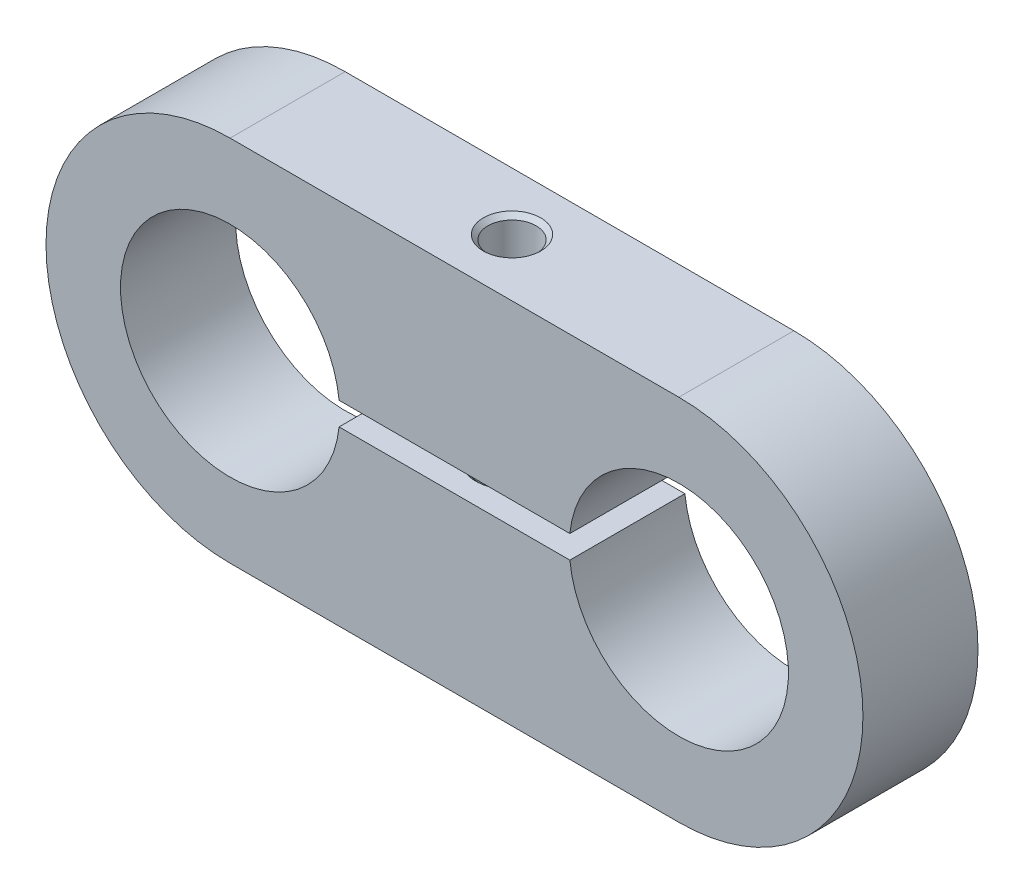
from build123d import *

# Parameters (mm, degrees)
BOSS_EXTRUDE1_DEPTH        = 10
CUT_EXTRUDE1_DEPTH         = 59.14636704
SKETCH3_W                  = 11
SKETCH3_H                  = 10
SKETCH4_W                  = 11
SKETCH4_H                  = 10
F_10_CLEARANCE_HOLE1_D     = 5.5
F_10_CLEARANCE_HOLE1_DEPTH = 15
F_6_CLEARANCE_HOLE1_D      = 4.2
F_6_CLEARANCE_HOLE1_DEPTH  = 32
CHAMFER1_SIZE              = 0.4
BOSS_EXTRUDE2_DEPTH        = 10


with BuildPart() as part:
    # Sketch1 → Boss-Extrude1 (new body)
    with BuildSketch(Plane(origin=(0, 0, 0), x_dir=(-1, 0, 0), z_dir=(0, 0, -1))):
        with BuildLine():
            Line((0, 16), (-39, 16))
            ThreePointArc((-39, 16), (-55, 0), (-39, -16))
            Line((-39, -16), (0, -16))
            ThreePointArc((0, -16), (16, 0), (0, 16))
        make_face()
    extrude(amount=-BOSS_EXTRUDE1_DEPTH)

    # Sketch2 → Cut-Extrude1 (cut, through all)
    with BuildSketch(Plane.XY.offset(10)):
        with BuildLine():
            Line((28.04554885, 1), (10.95445115, 1))
            ThreePointArc((10.95445115, 1), (11, 0), (10.95445115, -1))
            Line((10.95445115, -1), (28.04554885, -1))
            ThreePointArc((28.04554885, -1), (28, 0), (28.04554885, 1))
        make_face()
    extrude(amount=-CUT_EXTRUDE1_DEPTH, mode=Mode.SUBTRACT)

    # Sketch3 → Cut-Revolve1 (revolve, cut)
    with BuildSketch(Plane.XZ):
        with Locations((44.5, 5)):
            Rectangle(SKETCH3_W, SKETCH3_H)
    revolve(axis=Axis((39, 0, 10), (0, 0, -1)), mode=Mode.SUBTRACT)

    # Sketch4 → Cut-Revolve2 (revolve, cut)
    with BuildSketch(Plane.XZ):
        with Locations((5.5, 5)):
            Rectangle(SKETCH4_W, SKETCH4_H)
    revolve(axis=Axis((0, 0, 10), (0, 0, -1)), mode=Mode.SUBTRACT)

    # #10 Clearance Hole1
    with Locations(Plane(origin=(0, -16, 0), x_dir=(-1, 0, 0), z_dir=(0, -1, 0))):
        with Locations((-19.5, -5)):
            Hole(F_10_CLEARANCE_HOLE1_D / 2, depth=F_10_CLEARANCE_HOLE1_DEPTH)

    # #6 Clearance Hole1
    with Locations(Plane(origin=(0, 16, 0), x_dir=(1, 0, 0), z_dir=(0, 1, 0))):
        with Locations((19.5, -5)):
            Hole(F_6_CLEARANCE_HOLE1_D / 2, depth=F_6_CLEARANCE_HOLE1_DEPTH)

    # Chamfer1
    chamfer1_edges = [part.edges().sort_by_distance(p)[0] for p in [
        (16.75, -16, 5),
        (16.75, -1, 5),
        (21.6, 1, 5),
        (21.6, 16, 5),
    ]]
    chamfer(chamfer1_edges, length=CHAMFER1_SIZE)

    # Sketch9 → Boss-Extrude2 (add)
    with BuildSketch(Plane.XY.offset(10)):
        with BuildLine():
            Line((10.95445115, 1), (9.47236111, 1))
            ThreePointArc((9.47236111, 1), (-9.525, 0), (9.47236111, -1))
            Line((9.47236111, -1), (10.95445115, -1))
            ThreePointArc((10.95445115, -1), (-11, 0), (10.95445115, 1))
        make_face()
        with BuildLine():
            Line((28.04554885, -1), (29.52763889, -1))
            ThreePointArc((29.52763889, -1), (48.525, 0), (29.52763889, 1))
            Line((29.52763889, 1), (28.04554885, 1))
            ThreePointArc((28.04554885, 1), (50, 0), (28.04554885, -1))
        make_face()
    extrude(amount=-BOSS_EXTRUDE2_DEPTH)


solid = part.part
